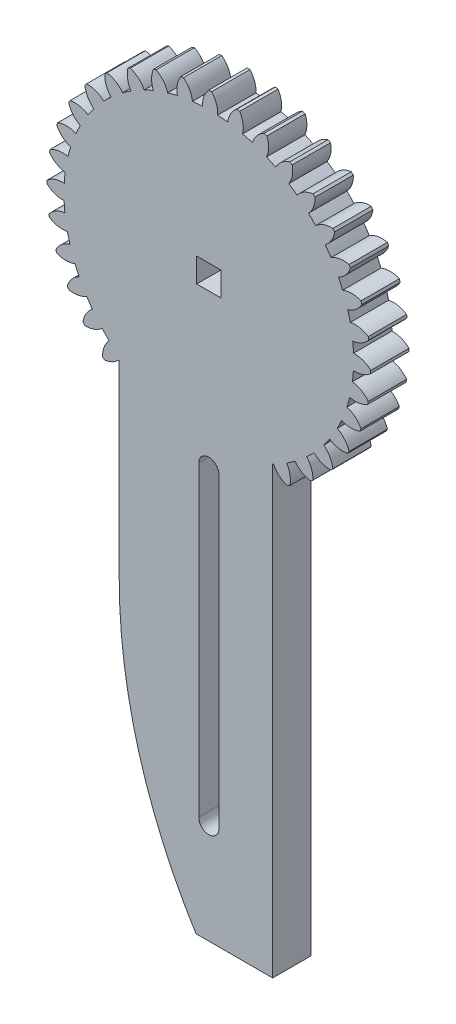
from build123d import *

# Parameters (mm, degrees)
SKETCH3_W           = 3
SKETCH3_H           = 3
BOSS_EXTRUDE2_DEPTH = 4.7625
CUT_EXTRUDE1_DEPTH  = 10.16


with BuildPart() as part:
    # Sketch3 → Boss-Extrude2 (new body)
    # profile 1 of 2: a face of its own
    with BuildSketch(Plane.XY):
        with BuildLine():
            Line((-1.6002, -71.4248), (7.9248, -71.4248))
            Line((7.9248, -71.4248), (7.9248, -12.7))
            Line((7.9248, -12.7), (-11.1252, -12.7))
            Line((-11.1252, -12.7), (-11.1252, -38.1))
            ThreePointArc((-11.1252, -38.1), (-8.697206621, -55.429656085), (-1.6002, -71.4248))
        make_face()
    # profile 2 of 2: a face of its own
    with BuildSketch(Plane.XY):
        with BuildLine():
            ThreePointArc((-17.153553076, 5.408494509), (-17.331857331, 4.806549432), (-17.489045388, 4.198748315))
            ThreePointArc((-17.489045388, 4.198748315), (-18.648249047, 4.242523406), (-19.734731059, 3.836043123))
            ThreePointArc((-19.734731059, 3.836043123), (-19.767454987, 3.663681227), (-19.798673548, 3.491040328))
            ThreePointArc((-19.798673548, 3.491040328), (-18.930024713, 2.722197962), (-17.832127277, 2.347644092))
            ThreePointArc((-17.832127277, 2.347644092), (-17.903196024, 1.723881704), (-17.952452485, 1.098019031))
            ThreePointArc((-17.952452485, 1.098019031), (-19.1016467, 0.939835478), (-20.101038048, 0.350864924))
            ThreePointArc((-20.101038048, 0.350864924), (-20.103334497, 0.175439142), (-20.1041, 0))
            ThreePointArc((-20.1041, 0), (-19.115139817, -0.606322635), (-17.968881314, -0.784538301))
            ThreePointArc((-17.968881314, -0.784538301), (-17.930555165, -1.411165297), (-17.870383396, -2.036073004))
            ThreePointArc((-17.870383396, -2.036073004), (-18.974650483, -2.391408875), (-19.856585168, -3.144974129))
            ThreePointArc((-19.856585168, -3.144974129), (-19.828384362, -3.318133573), (-19.798673547, -3.491040329))
            ThreePointArc((-19.798673547, -3.491040329), (-18.719451071, -3.916420428), (-17.559659984, -3.892882897))
            ThreePointArc((-17.559659984, -3.892882897), (-17.41310346, -4.503334753), (-17.245331751, -5.10829999))
            ThreePointArc((-17.245331751, -5.10829999), (-18.271119114, -5.649991478), (-19.008799995, -6.545254734))
            ThreePointArc((-19.008799995, -6.545254734), (-18.950958801, -6.710886479), (-18.891674417, -6.876007163))
            ThreePointArc((-18.891674417, -6.876007163), (-17.754981276, -7.107519766), (-16.616897271, -6.882944214))
            ThreePointArc((-16.616897271, -6.882944214), (-16.366563418, -7.458672662), (-16.096289427, -8.025313866))
            ThreePointArc((-16.096289427, -8.025313866), (-17.012429035, -8.73690195), (-17.583442053, -9.746661087))
            ThreePointArc((-17.583442053, -9.746661087), (-17.497717946, -9.899732495), (-17.410661319, -10.052050001))
            ThreePointArc((-17.410661319, -10.052050001), (-16.25103536, -10.082660714), (-15.169238544, -9.663870756))
            ThreePointArc((-15.169238544, -9.663870756), (-14.822733628, -10.187382578), (-14.458169495, -10.698482643))
            ThreePointArc((-14.458169495, -10.698482643), (-15.236824909, -11.558346078), (-15.623820123, -12.651920074))
            ThreePointArc((-15.623820123, -12.651920074), (-15.512817786, -12.787780149), (-15.400634088, -12.922666385))
            ThreePointArc((-15.400634088, -12.922666385), (-14.253309958, -12.751445119), (-13.260670179, -12.151165475))
            ThreePointArc((-13.260670179, -12.151165475), (-12.828522578, -12.606554028), (-12.380745398, -13.046583437))
            ThreePointArc((-12.380745398, -13.046583437), (-12.998257569, -14.028595708), (-13.189476325, -15.172756872))
            ThreePointArc((-13.189476325, -15.172756872), (-13.056568509, -15.287277573), (-12.922666384, -15.400634089))
            ThreePointArc((-12.922666384, -15.400634089), (-11.822504947, -15.032783314), (-10.949183062, -14.269253178))
            ThreePointArc((-10.949183062, -14.269253178), (-10.444523361, -14.642681713), (-9.927138617, -14.998270395))
            ThreePointArc((-9.927138617, -14.998270395), (-10.36474475, -16.072593557), (-10.354376961, -17.232577131))
            ThreePointArc((-10.354376961, -17.232577131), (-10.203602002, -17.322278805), (-10.052049999, -17.410661321))
            ThreePointArc((-10.052049999, -17.410661321), (-9.032479103, -16.857357997), (-8.305010557, -15.953776846))
            ThreePointArc((-8.305010557, -15.953776846), (-7.743172587, -16.233898925), (-7.171900753, -16.494242498))
            ThreePointArc((-7.171900753, -16.494242498), (-7.416304405, -17.628233784), (-7.204665094, -18.768794252))
            ThreePointArc((-7.204665094, -18.768794252), (-7.040604212, -18.83095136), (-6.876007162, -18.891674418))
            ThreePointArc((-6.876007162, -18.891674418), (-5.968005952, -18.169730386), (-5.408494509, -17.153553076))
            ThreePointArc((-5.408494509, -17.153553076), (-4.806549432, -17.331857331), (-4.198748315, -17.489045388))
            ThreePointArc((-4.198748315, -17.489045388), (-4.242523406, -18.648249047), (-3.836043123, -19.734731059))
            ThreePointArc((-3.836043123, -19.734731059), (-3.663681227, -19.767454987), (-3.491040328, -19.798673548))
            ThreePointArc((-3.491040328, -19.798673548), (-2.722197962, -18.930024713), (-2.347644092, -17.832127277))
            ThreePointArc((-2.347644092, -17.832127277), (-1.723881704, -17.903196024), (-1.098019031, -17.952452485))
            ThreePointArc((-1.098019031, -17.952452485), (-0.939835478, -19.1016467), (-0.350864924, -20.101038048))
            ThreePointArc((-0.350864924, -20.101038048), (-0.175439142, -20.103334497), (0, -20.1041))
            ThreePointArc((0, -20.1041), (0.606322635, -19.115139817), (0.784538301, -17.968881314))
            ThreePointArc((0.784538301, -17.968881314), (1.411165297, -17.930555165), (2.036073004, -17.870383396))
            ThreePointArc((2.036073004, -17.870383396), (2.391408875, -18.974650483), (3.144974129, -19.856585168))
            ThreePointArc((3.144974129, -19.856585168), (3.318133573, -19.828384362), (3.491040329, -19.798673547))
            ThreePointArc((3.491040329, -19.798673547), (3.916420428, -18.719451071), (3.892882897, -17.559659984))
            ThreePointArc((3.892882897, -17.559659984), (4.503334753, -17.41310346), (5.10829999, -17.245331751))
            ThreePointArc((5.10829999, -17.245331751), (5.649991478, -18.271119114), (6.545254734, -19.008799995))
            ThreePointArc((6.545254734, -19.008799995), (6.710886479, -18.950958801), (6.876007163, -18.891674417))
            ThreePointArc((6.876007163, -18.891674417), (7.107519766, -17.754981276), (6.882944214, -16.616897271))
            ThreePointArc((6.882944214, -16.616897271), (7.458672662, -16.366563418), (8.025313866, -16.096289427))
            ThreePointArc((8.025313866, -16.096289427), (8.73690195, -17.012429035), (9.746661087, -17.583442053))
            ThreePointArc((9.746661087, -17.583442053), (9.899732495, -17.497717946), (10.052050001, -17.410661319))
            ThreePointArc((10.052050001, -17.410661319), (10.082660714, -16.25103536), (9.663870756, -15.169238544))
            ThreePointArc((9.663870756, -15.169238544), (10.187382578, -14.822733628), (10.698482643, -14.458169495))
            ThreePointArc((10.698482643, -14.458169495), (11.558346078, -15.236824909), (12.651920074, -15.623820123))
            ThreePointArc((12.651920074, -15.623820123), (12.787780149, -15.512817786), (12.922666385, -15.400634088))
            ThreePointArc((12.922666385, -15.400634088), (12.751445119, -14.253309958), (12.151165475, -13.260670179))
            ThreePointArc((12.151165475, -13.260670179), (12.606554028, -12.828522578), (13.046583437, -12.380745398))
            ThreePointArc((13.046583437, -12.380745398), (14.028595708, -12.998257569), (15.172756872, -13.189476325))
            ThreePointArc((15.172756872, -13.189476325), (15.287277573, -13.056568509), (15.400634089, -12.922666384))
            ThreePointArc((15.400634089, -12.922666384), (15.032783314, -11.822504947), (14.269253178, -10.949183062))
            ThreePointArc((14.269253178, -10.949183062), (14.642681713, -10.444523361), (14.998270395, -9.927138617))
            ThreePointArc((14.998270395, -9.927138617), (16.072593557, -10.36474475), (17.232577131, -10.354376961))
            ThreePointArc((17.232577131, -10.354376961), (17.322278805, -10.203602002), (17.410661321, -10.052049999))
            ThreePointArc((17.410661321, -10.052049999), (16.857357997, -9.032479103), (15.953776846, -8.305010557))
            ThreePointArc((15.953776846, -8.305010557), (16.233898925, -7.743172587), (16.494242498, -7.171900753))
            ThreePointArc((16.494242498, -7.171900753), (17.628233784, -7.416304405), (18.768794252, -7.204665094))
            ThreePointArc((18.768794252, -7.204665094), (18.83095136, -7.040604212), (18.891674418, -6.876007162))
            ThreePointArc((18.891674418, -6.876007162), (18.169730386, -5.968005952), (17.153553076, -5.408494509))
            ThreePointArc((17.153553076, -5.408494509), (17.331857331, -4.806549432), (17.489045388, -4.198748315))
            ThreePointArc((17.489045388, -4.198748315), (18.648249047, -4.242523406), (19.734731059, -3.836043123))
            ThreePointArc((19.734731059, -3.836043123), (19.767454987, -3.663681227), (19.798673548, -3.491040328))
            ThreePointArc((19.798673548, -3.491040328), (18.930024713, -2.722197962), (17.832127277, -2.347644092))
            ThreePointArc((17.832127277, -2.347644092), (17.903196024, -1.723881704), (17.952452485, -1.098019031))
            ThreePointArc((17.952452485, -1.098019031), (19.1016467, -0.939835478), (20.101038048, -0.350864924))
            ThreePointArc((20.101038048, -0.350864924), (20.103334497, -0.175439142), (20.1041, 0))
            ThreePointArc((20.1041, 0), (19.115139817, 0.606322635), (17.968881314, 0.784538301))
            ThreePointArc((17.968881314, 0.784538301), (17.930555165, 1.411165297), (17.870383396, 2.036073004))
            ThreePointArc((17.870383396, 2.036073004), (18.974650483, 2.391408875), (19.856585168, 3.144974129))
            ThreePointArc((19.856585168, 3.144974129), (19.828384362, 3.318133573), (19.798673547, 3.491040329))
            ThreePointArc((19.798673547, 3.491040329), (18.719451071, 3.916420428), (17.559659984, 3.892882897))
            ThreePointArc((17.559659984, 3.892882897), (17.41310346, 4.503334753), (17.245331751, 5.10829999))
            ThreePointArc((17.245331751, 5.10829999), (18.271119114, 5.649991478), (19.008799995, 6.545254734))
            ThreePointArc((19.008799995, 6.545254734), (18.950958801, 6.710886479), (18.891674417, 6.876007163))
            ThreePointArc((18.891674417, 6.876007163), (17.754981276, 7.107519766), (16.616897271, 6.882944214))
            ThreePointArc((16.616897271, 6.882944214), (16.366563418, 7.458672662), (16.096289427, 8.025313866))
            ThreePointArc((16.096289427, 8.025313866), (17.012429035, 8.73690195), (17.583442053, 9.746661087))
            ThreePointArc((17.583442053, 9.746661087), (17.497717946, 9.899732495), (17.410661319, 10.052050001))
            ThreePointArc((17.410661319, 10.052050001), (16.25103536, 10.082660714), (15.169238544, 9.663870756))
            ThreePointArc((15.169238544, 9.663870756), (14.822733628, 10.187382578), (14.458169495, 10.698482643))
            ThreePointArc((14.458169495, 10.698482643), (15.236824909, 11.558346078), (15.623820123, 12.651920074))
            ThreePointArc((15.623820123, 12.651920074), (15.512817786, 12.787780149), (15.400634088, 12.922666385))
            ThreePointArc((15.400634088, 12.922666385), (14.253309958, 12.751445119), (13.260670179, 12.151165475))
            ThreePointArc((13.260670179, 12.151165475), (12.828522578, 12.606554028), (12.380745398, 13.046583437))
            ThreePointArc((12.380745398, 13.046583437), (12.998257569, 14.028595708), (13.189476325, 15.172756872))
            ThreePointArc((13.189476325, 15.172756872), (13.056568509, 15.287277573), (12.922666384, 15.400634089))
            ThreePointArc((12.922666384, 15.400634089), (11.822504947, 15.032783314), (10.949183062, 14.269253178))
            ThreePointArc((10.949183062, 14.269253178), (10.444523361, 14.642681713), (9.927138617, 14.998270395))
            ThreePointArc((9.927138617, 14.998270395), (10.36474475, 16.072593557), (10.354376961, 17.232577131))
            ThreePointArc((10.354376961, 17.232577131), (10.203602002, 17.322278805), (10.052049999, 17.410661321))
            ThreePointArc((10.052049999, 17.410661321), (9.032479103, 16.857357997), (8.305010557, 15.953776846))
            ThreePointArc((8.305010557, 15.953776846), (7.743172587, 16.233898925), (7.171900753, 16.494242498))
            ThreePointArc((7.171900753, 16.494242498), (7.416304405, 17.628233784), (7.204665094, 18.768794252))
            ThreePointArc((7.204665094, 18.768794252), (7.040604212, 18.83095136), (6.876007162, 18.891674418))
            ThreePointArc((6.876007162, 18.891674418), (5.968005952, 18.169730386), (5.408494509, 17.153553076))
            ThreePointArc((5.408494509, 17.153553076), (4.806549432, 17.331857331), (4.198748315, 17.489045388))
            ThreePointArc((4.198748315, 17.489045388), (4.242523406, 18.648249047), (3.836043123, 19.734731059))
            ThreePointArc((3.836043123, 19.734731059), (3.663681227, 19.767454987), (3.491040328, 19.798673548))
            ThreePointArc((3.491040328, 19.798673548), (2.722197962, 18.930024713), (2.347644092, 17.832127277))
            ThreePointArc((2.347644092, 17.832127277), (1.723881704, 17.903196024), (1.098019031, 17.952452485))
            ThreePointArc((1.098019031, 17.952452485), (0.939835478, 19.1016467), (0.350864924, 20.101038048))
            ThreePointArc((0.350864924, 20.101038048), (0.175439142, 20.103334497), (0, 20.1041))
            ThreePointArc((0, 20.1041), (-0.606322635, 19.115139817), (-0.784538301, 17.968881314))
            ThreePointArc((-0.784538301, 17.968881314), (-1.411165297, 17.930555165), (-2.036073004, 17.870383396))
            ThreePointArc((-2.036073004, 17.870383396), (-2.391408875, 18.974650483), (-3.144974129, 19.856585168))
            ThreePointArc((-3.144974129, 19.856585168), (-3.318133573, 19.828384362), (-3.491040329, 19.798673547))
            ThreePointArc((-3.491040329, 19.798673547), (-3.916420428, 18.719451071), (-3.892882897, 17.559659984))
            ThreePointArc((-3.892882897, 17.559659984), (-4.503334753, 17.41310346), (-5.10829999, 17.245331751))
            ThreePointArc((-5.10829999, 17.245331751), (-5.649991478, 18.271119114), (-6.545254734, 19.008799995))
            ThreePointArc((-6.545254734, 19.008799995), (-6.710886479, 18.950958801), (-6.876007163, 18.891674417))
            ThreePointArc((-6.876007163, 18.891674417), (-7.107519766, 17.754981276), (-6.882944214, 16.616897271))
            ThreePointArc((-6.882944214, 16.616897271), (-7.458672662, 16.366563418), (-8.025313866, 16.096289427))
            ThreePointArc((-8.025313866, 16.096289427), (-8.73690195, 17.012429035), (-9.746661087, 17.583442053))
            ThreePointArc((-9.746661087, 17.583442053), (-9.899732495, 17.497717946), (-10.052050001, 17.410661319))
            ThreePointArc((-10.052050001, 17.410661319), (-10.082660714, 16.25103536), (-9.663870756, 15.169238544))
            ThreePointArc((-9.663870756, 15.169238544), (-10.187382578, 14.822733628), (-10.698482643, 14.458169495))
            ThreePointArc((-10.698482643, 14.458169495), (-11.558346078, 15.236824909), (-12.651920074, 15.623820123))
            ThreePointArc((-12.651920074, 15.623820123), (-12.787780149, 15.512817786), (-12.922666385, 15.400634088))
            ThreePointArc((-12.922666385, 15.400634088), (-12.751445119, 14.253309958), (-12.151165475, 13.260670179))
            ThreePointArc((-12.151165475, 13.260670179), (-12.606554028, 12.828522578), (-13.046583437, 12.380745398))
            ThreePointArc((-13.046583437, 12.380745398), (-14.028595708, 12.998257569), (-15.172756872, 13.189476325))
            ThreePointArc((-15.172756872, 13.189476325), (-15.287277573, 13.056568509), (-15.400634089, 12.922666384))
            ThreePointArc((-15.400634089, 12.922666384), (-15.032783314, 11.822504947), (-14.269253178, 10.949183062))
            ThreePointArc((-14.269253178, 10.949183062), (-14.642681713, 10.444523361), (-14.998270396, 9.927138618))
            ThreePointArc((-14.998270396, 9.927138618), (-16.072593557, 10.36474475), (-17.232577131, 10.354376961))
            ThreePointArc((-17.232577131, 10.354376961), (-17.322278805, 10.203602002), (-17.410661321, 10.052049999))
            ThreePointArc((-17.410661321, 10.052049999), (-16.857357997, 9.032479103), (-15.953776846, 8.305010557))
            ThreePointArc((-15.953776846, 8.305010557), (-16.233898925, 7.743172587), (-16.494242498, 7.171900753))
            ThreePointArc((-16.494242498, 7.171900753), (-17.628233784, 7.416304405), (-18.768794252, 7.204665094))
            ThreePointArc((-18.768794252, 7.204665094), (-18.83095136, 7.040604212), (-18.891674418, 6.876007162))
            ThreePointArc((-18.891674418, 6.876007162), (-18.169730386, 5.968005952), (-17.153553076, 5.408494509))
        make_face()
        Rectangle(SKETCH3_W, SKETCH3_H, mode=Mode.SUBTRACT)
    extrude(amount=BOSS_EXTRUDE2_DEPTH)

    # Sketch5 → Cut-Extrude1 (cut)
    with BuildSketch(Plane.XY.offset(4.7625)):
        with BuildLine():
            Line((-1.25, -58.7248), (-1.25, -20.6248))
            ThreePointArc((-1.25, -20.6248), (0, -19.3748), (1.25, -20.6248))
            Line((1.25, -20.6248), (1.25, -58.7248))
            ThreePointArc((1.25, -58.7248), (0, -59.9748), (-1.25, -58.7248))
        make_face()
    extrude(amount=-CUT_EXTRUDE1_DEPTH, mode=Mode.SUBTRACT)


solid = part.part
